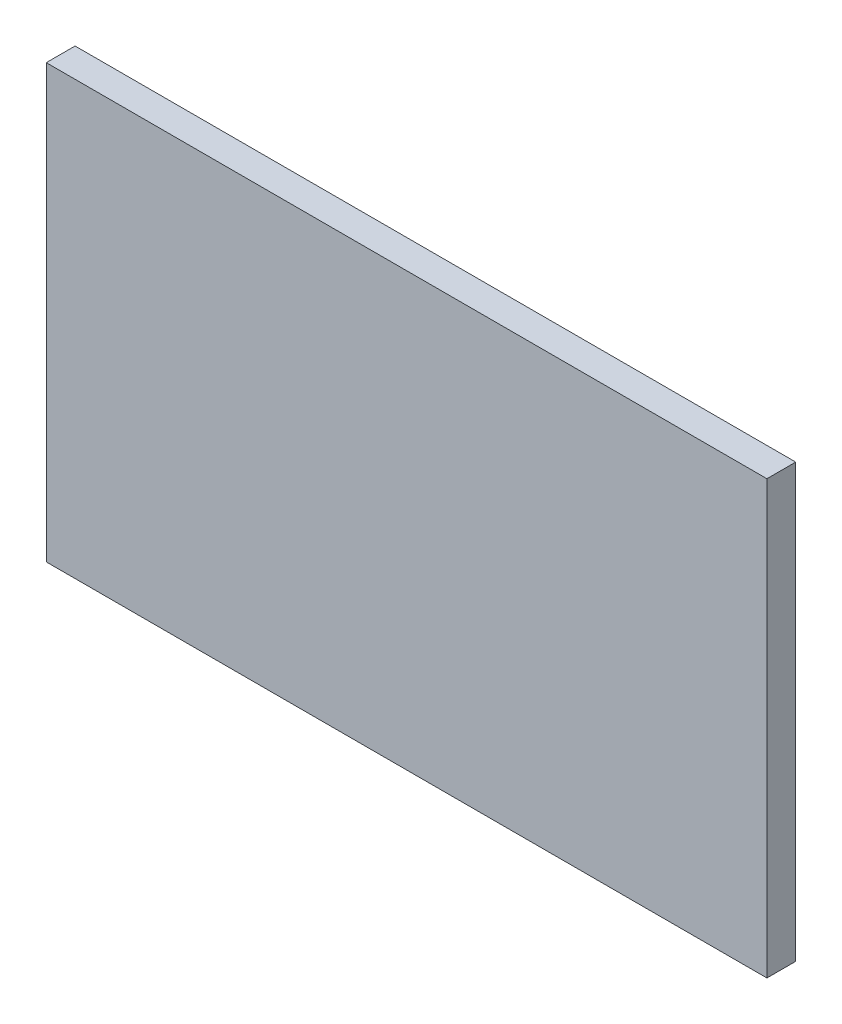
from build123d import *

# Parameters (mm, degrees)
SKETCH1_W           = 25
SKETCH1_H           = 15
BOSS_EXTRUDE1_DEPTH = 1


with BuildPart() as part:
    # Sketch1 → Boss-Extrude1 (new body)
    with BuildSketch(Plane.XY):
        Rectangle(SKETCH1_W, SKETCH1_H)
    extrude(amount=BOSS_EXTRUDE1_DEPTH)


solid = part.part
